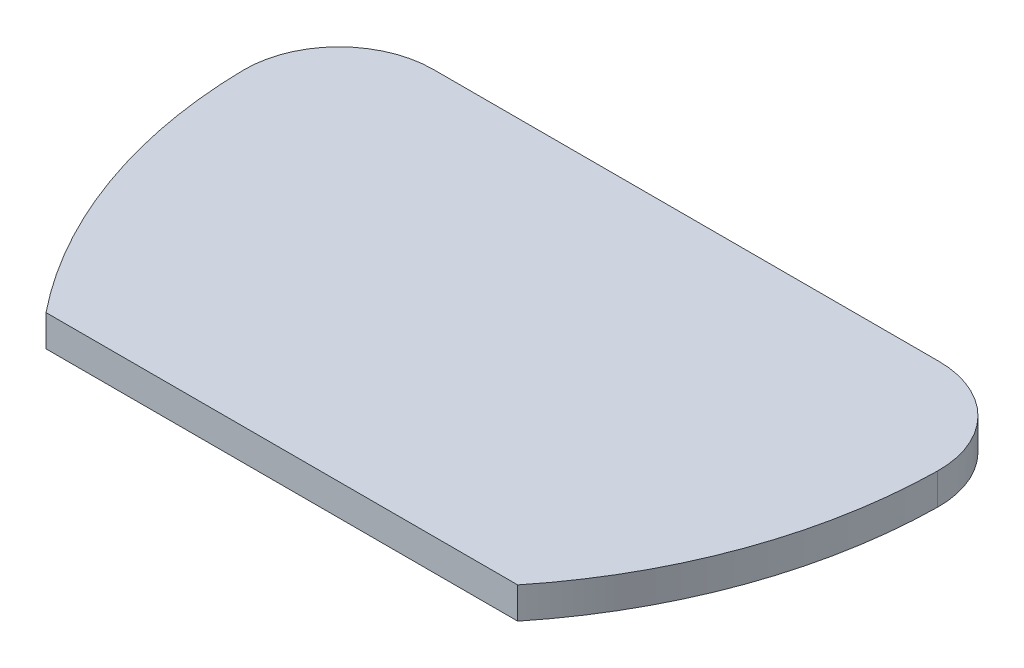
from build123d import *

# Parameters (mm, degrees)
EXTRUDE3_DEPTH = 6.35


with BuildPart() as part:
    # Sketch12 → Extrude3 (new body)
    with BuildSketch(Plane(origin=(0, 0, 0), x_dir=(1, 0, 0), z_dir=(0, 1, 0))):
        with BuildLine():
            Line((47.659255792, 0), (-47.659255792, 0))
            ThreePointArc((-47.659255792, 0), (-64.107574089, 29.295195073), (-70.144576115, 62.345312104))
            ThreePointArc((-70.144576115, 62.345312104), (-64.669164862, 76.002515657), (-51.096777519, 81.684912961))
            Line((-51.096777519, 81.684912961), (51.096777519, 81.684912961))
            ThreePointArc((51.096777519, 81.684912961), (64.669164862, 76.002515657), (70.144576115, 62.345312104))
            ThreePointArc((70.144576115, 62.345312104), (64.107574089, 29.295195073), (47.659255792, 0))
        make_face()
    extrude(amount=-EXTRUDE3_DEPTH)


solid = part.part
